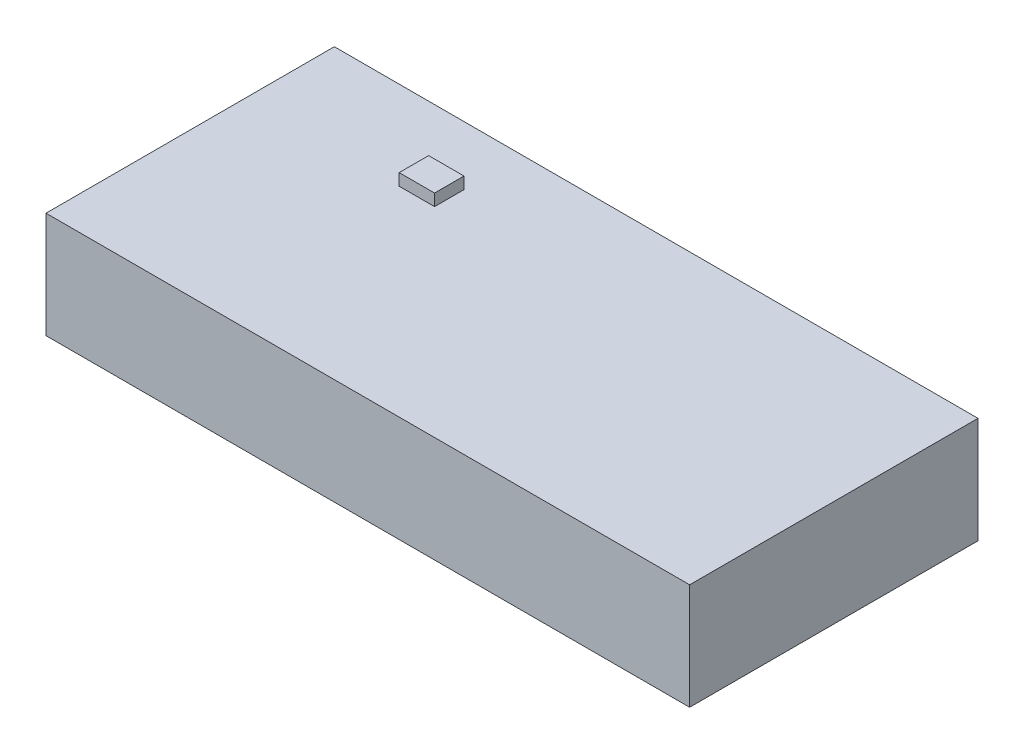
from build123d import *

# Parameters (mm, degrees)
SKETCH1_W           = 138.684
SKETCH1_H           = 62.1284
BOSS_EXTRUDE1_DEPTH = 11.43
SKETCH3_W           = 12.7
SKETCH3_H           = 6.35
CUT_EXTRUDE1_DEPTH  = 12.7
SKETCH4_W           = 7.62
SKETCH4_H           = 6.35
BOSS_EXTRUDE2_DEPTH = 2.54


with BuildPart() as part:
    # Sketch1 → Boss-Extrude1 (new, symmetric)
    with BuildSketch(Plane(origin=(0, 0, 0), x_dir=(1, 0, 0), z_dir=(0, 1, 0))):
        Rectangle(SKETCH1_W, SKETCH1_H)
    extrude(amount=BOSS_EXTRUDE1_DEPTH, both=True)

    # Sketch3 → Cut-Extrude1 (cut)
    with BuildSketch(Plane(origin=(0, 0, -31.0642), x_dir=(-1, 0, 0), z_dir=(0, 0, -1))):
        with Locations((29.972, 0)):
            Rectangle(SKETCH3_W, SKETCH3_H)
        with Locations((50.292, 0)):
            Rectangle(SKETCH3_W, SKETCH3_H)
    extrude(amount=-CUT_EXTRUDE1_DEPTH, mode=Mode.SUBTRACT)

    # Sketch4 → Boss-Extrude2 (add)
    with BuildSketch(Plane(origin=(0, 11.43, 0), x_dir=(1, 0, 0), z_dir=(0, 1, 0))):
        with Locations((-32.512, 15.1892)):
            Rectangle(SKETCH4_W, SKETCH4_H)
    extrude(amount=BOSS_EXTRUDE2_DEPTH)


solid = part.part
